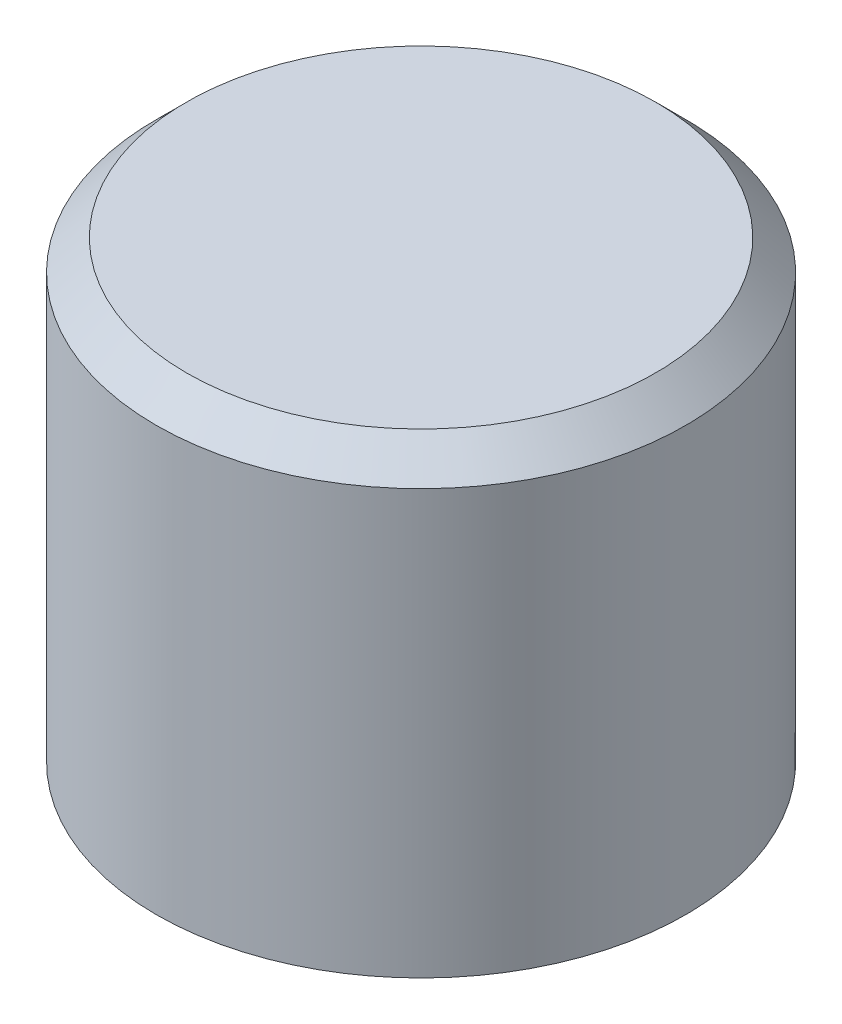
from build123d import *

# Parameters (mm, degrees)
SKETCH1_R           = 8.75
BOSS_EXTRUDE1_DEPTH = 15
SKETCH2_R           = 7
CUT_EXTRUDE1_DEPTH  = 8
CUT_EXTRUDE2_DEPTH  = 5.5
CHAMFER1_SIZE       = 1
CHAMFER2_SIZE       = 1


with BuildPart() as part:
    # Sketch1 → Boss-Extrude1 (new body)
    with BuildSketch(Plane(origin=(0, 0, 0), x_dir=(1, 0, 0), z_dir=(0, 1, 0))):
        with Locations(Location((0, 0, 0), (0, 0, 270))):
            Circle(SKETCH1_R)
    extrude(amount=BOSS_EXTRUDE1_DEPTH)

    # Sketch2 → Cut-Extrude1 (cut)
    with BuildSketch(Plane.XZ):
        with Locations(Location((0, 0, 0), (0, 0, 270))):
            Circle(SKETCH2_R)
    extrude(amount=-CUT_EXTRUDE1_DEPTH, mode=Mode.SUBTRACT)

    # Sketch3 → Cut-Extrude2 (cut)
    with BuildSketch(Plane.XZ.offset(-8)):
        with BuildLine():
            Line((-2.75, 1.732050808), (2.75, 1.732050808))
            ThreePointArc((2.75, 1.732050808), (0, -3.25), (-2.75, 1.732050808))
        make_face()
    extrude(amount=-CUT_EXTRUDE2_DEPTH, mode=Mode.SUBTRACT)

    # Chamfer1
    chamfer1_edges = [part.edges().sort_by_distance(p)[0] for p in [
        (0, 15, -8.75),
    ]]
    chamfer(chamfer1_edges, length=CHAMFER1_SIZE)

    # Chamfer2
    chamfer2_edges = [part.edges().sort_by_distance(p)[0] for p in [
        (0, 8, -3.25),
        (0, 8, 1.732050808),
    ]]
    chamfer(chamfer2_edges, length=CHAMFER2_SIZE)


solid = part.part
